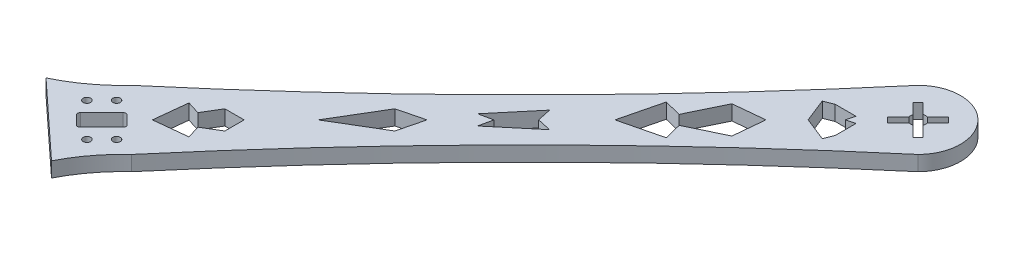
from build123d import *

# Parameters (mm, degrees)
SKETCH1_R           = 1.25
BOSS_EXTRUDE9_DEPTH = 5
CUT_EXTRUDE1_DEPTH  = 10


with BuildPart() as part:
    # Sketch1 → Boss-Extrude9 (new body)
    with BuildSketch(Plane(origin=(0, 0, 0), x_dir=(1, 0, 0), z_dir=(0, 1, 0))):
        with BuildLine():
            Line((23.600035939, 26.479209334), (48.489298853, 3.430633728))
            ThreePointArc((48.489298853, 3.430633728), (53.57304499, 11.525457211), (59.99370362, 18.606826058))
            ThreePointArc((59.99370362, 18.606826058), (122.945468319, 87.076417595), (191.415059857, 150.028182295))
            ThreePointArc((191.415059857, 150.028182295), (191.413333308, 170.020159366), (171.421356237, 170.021885915))
            ThreePointArc((171.421356237, 170.021885915), (108.469591538, 101.552294377), (40, 38.600529677))
            ThreePointArc((40, 38.600529677), (32.372407148, 31.765435558), (23.600035939, 26.479209334))
        make_face()
        with Locations(Location((41.868272016, 31.782510193, 0), (0, 0, 270))):
            Circle(SKETCH1_R, mode=Mode.SUBTRACT)
        with Locations(Location((36.918524548, 26.832762725, 0), (0, 0, 270))):
            Circle(SKETCH1_R, mode=Mode.SUBTRACT)
        with Locations(Location((48.232233047, 15.519054226, 0), (0, 0, 270))):
            Circle(SKETCH1_R, mode=Mode.SUBTRACT)
        with Locations(Location((53.181980515, 20.468801694, 0), (0, 0, 270))):
            Circle(SKETCH1_R, mode=Mode.SUBTRACT)
        with BuildLine():
            Line((187.351349634, 164.261119417), (185.65429336, 165.958175692))
            Line((185.65429336, 165.958175692), (182.118759454, 162.422641786))
            ThreePointArc((182.118759454, 162.422641786), (181.416481349, 162.523307407), (180.714203245, 162.422641786))
            Line((180.714203245, 162.422641786), (177.178669339, 165.958175692))
            Line((177.178669339, 165.958175692), (175.481613064, 164.261119417))
            Line((175.481613064, 164.261119417), (179.01714697, 160.725585511))
            ThreePointArc((179.01714697, 160.725585511), (178.916481349, 160.023307407), (179.01714697, 159.321029302))
            Line((179.01714697, 159.321029302), (175.481613064, 155.785495396))
            Line((175.481613064, 155.785495396), (177.178669339, 154.088439122))
            Line((177.178669339, 154.088439122), (180.714203245, 157.623973027))
            ThreePointArc((180.714203245, 157.623973027), (181.416481349, 157.523307407), (182.118759454, 157.623973027))
            Line((182.118759454, 157.623973027), (185.65429336, 154.088439122))
            Line((185.65429336, 154.088439122), (187.351349634, 155.785495396))
            Line((187.351349634, 155.785495396), (183.815815728, 159.321029302))
            ThreePointArc((183.815815728, 159.321029302), (183.916481349, 160.023307407), (183.815815728, 160.725585511))
            Line((183.815815728, 160.725585511), (187.351349634, 164.261119417))
        make_face(mode=Mode.SUBTRACT)
        with BuildLine():
            Line((47.878679656, 29.307636459), (50.707106781, 26.479209334))
            ThreePointArc((50.707106781, 26.479209334), (51, 25.772102553), (50.707106781, 25.064995772))
            Line((50.707106781, 25.064995772), (43.636038969, 17.99392796))
            ThreePointArc((43.636038969, 17.99392796), (42.928932188, 17.701034741), (42.221825407, 17.99392796))
            Line((42.221825407, 17.99392796), (39.393398282, 20.822355084))
            ThreePointArc((39.393398282, 20.822355084), (39.100505063, 21.529461866), (39.393398282, 22.236568647))
            Line((39.393398282, 22.236568647), (46.464466094, 29.307636459))
            ThreePointArc((46.464466094, 29.307636459), (47.171572875, 29.600529677), (47.878679656, 29.307636459))
        make_face(mode=Mode.SUBTRACT)
    extrude(amount=BOSS_EXTRUDE9_DEPTH)

    # Sketch3 → Cut-Extrude1 (cut)
    with BuildSketch(Plane(origin=(0, 5, 0), x_dir=(1, 0, 0), z_dir=(0, 1, 0))):
        Polygon((53.506506714, 32.107245232), (54.710738681, 43.14334784), (58.999320763, 41.803165939), (62.394448245, 47.431929922), (68.830431901, 47.431929922), (68.830750881, 40.995946275), (63.202155174, 37.600539824), (64.542549624, 33.312024169), align=None)
        Polygon((81.21135591, 59.813467571), (90.79476364, 75.829325012), (99.384762751, 77.987775145), (97.226738359, 69.397669067), align=None)
        Polygon((118.033043481, 96.636980145), (117.02456542, 101.302497895), (106.053446407, 88.187597005), (110.557637166, 89.161203324), (109.584254085, 84.656964316), (122.698611208, 95.628733318), align=None)
        Polygon((130.769320539, 109.373888454), (134.174820431, 123.118631106), (139.902949275, 121.699387207), (145.650358709, 133.585330855), (155.989652523, 134.59547044), (154.980025376, 124.256126574), (143.094366596, 118.508128056), (144.513894391, 112.780069559), align=None)
        Polygon((163.041484482, 141.647651911), (159.946738621, 149.458162099), (163.041484482, 150.684388263), (169.998774874, 150.684388263), (169.246288288, 147.852763247), (172.077876006, 148.605390173), (172.078220823, 141.64809979), (170.852148043, 138.553293158), align=None)
    extrude(amount=-CUT_EXTRUDE1_DEPTH, mode=Mode.SUBTRACT)


solid = part.part
